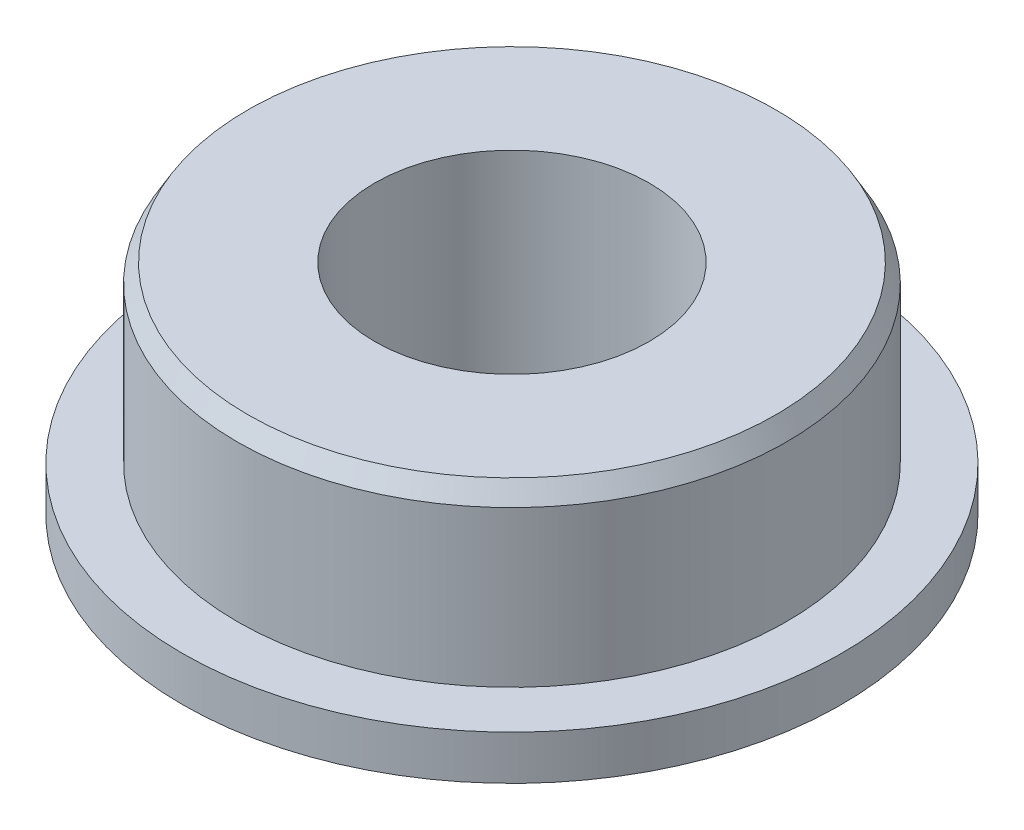
from build123d import *
from OCP.BRepFilletAPI import BRepFilletAPI_MakeChamfer

# Parameters (mm, degrees)
SKETCH_1_R      = 3
SKETCH_1_R_2    = 1.5
EXTRUDE_1_DEPTH = 2.5
SKETCH_1_3_R    = 3.6
SKETCH_1_3_R_2  = 3
EXTRUDE_2_DEPTH = 0.6
CHAMFER_1_SIZE  = 0.2
CHAMFER_1_SIZE2 = 0.115470054


with BuildPart() as part:
    # 草图1 → 凸台-拉伸1 (new body)
    with BuildSketch(Plane(origin=(0, 0, 0), x_dir=(1, 0, 0), z_dir=(0, 1, 0))):
        Circle(SKETCH_1_R)
        Circle(SKETCH_1_R_2, mode=Mode.SUBTRACT)
    extrude(amount=EXTRUDE_1_DEPTH)

    # 草图1<3> → 凸台-拉伸2 (add)
    with BuildSketch(Plane(origin=(0, 0, 0), x_dir=(1, 0, 0), z_dir=(0, 1, 0))):
        Circle(SKETCH_1_3_R)
        Circle(SKETCH_1_3_R_2, mode=Mode.SUBTRACT)
    extrude(amount=EXTRUDE_2_DEPTH)

    # 倒角1: one chamfer whose edges measure the first distance from different faces: ONE call of the kernel's chamfer builder (chamfer() names one face for all edges)
    chamfer_1_edges_1 = [part.edges().sort_by_distance(p)[0] for p in [
        (-3, 2.5, 0),
    ]]
    chamfer_1_side_1 = [part.faces().sort_by_distance(p)[0] for p in [
        (-3, 1.55, 0),
    ]]
    chamfer_1_edges_2 = [part.edges().sort_by_distance(p)[0] for p in [
        (-3.6, 0, 0),
    ]]
    chamfer_1_side_2 = [part.faces().sort_by_distance(p)[0] for p in [
        (-3.498176624, 0, 0),
    ]]
    chamfer_1 = BRepFilletAPI_MakeChamfer(part.part.solid().wrapped)
    for e in chamfer_1_edges_1:
        chamfer_1.Add(CHAMFER_1_SIZE, CHAMFER_1_SIZE2, e.wrapped, chamfer_1_side_1[0].wrapped)  # the first distance lies on this face
    for e in chamfer_1_edges_2:
        chamfer_1.Add(CHAMFER_1_SIZE, CHAMFER_1_SIZE2, e.wrapped, chamfer_1_side_2[0].wrapped)  # the first distance lies on this face
    add(Compound.cast(chamfer_1.Shape()), mode=Mode.REPLACE)


solid = part.part
